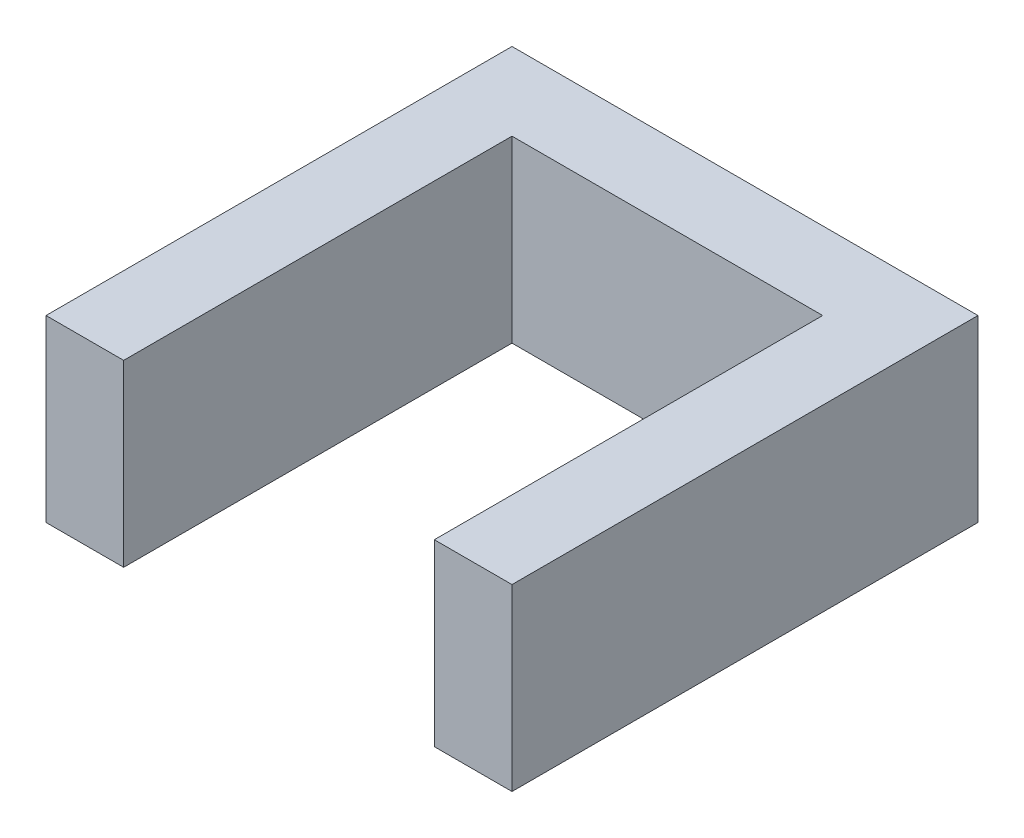
from build123d import *

# Parameters (mm, degrees)
BOSS_EXTRUDE1_DEPTH = 11.54


with BuildPart() as part:
    # Sketch1 → Boss-Extrude1 (new body)
    with BuildSketch(Plane(origin=(0, 0, 0), x_dir=(1, 0, 0), z_dir=(0, 1, 0))):
        Polygon((0, 0), (0, 30), (30, 30), (30, 0), (25, 0), (25, 25), (5, 25), (5, 0), align=None)
    extrude(amount=BOSS_EXTRUDE1_DEPTH)


solid = part.part
